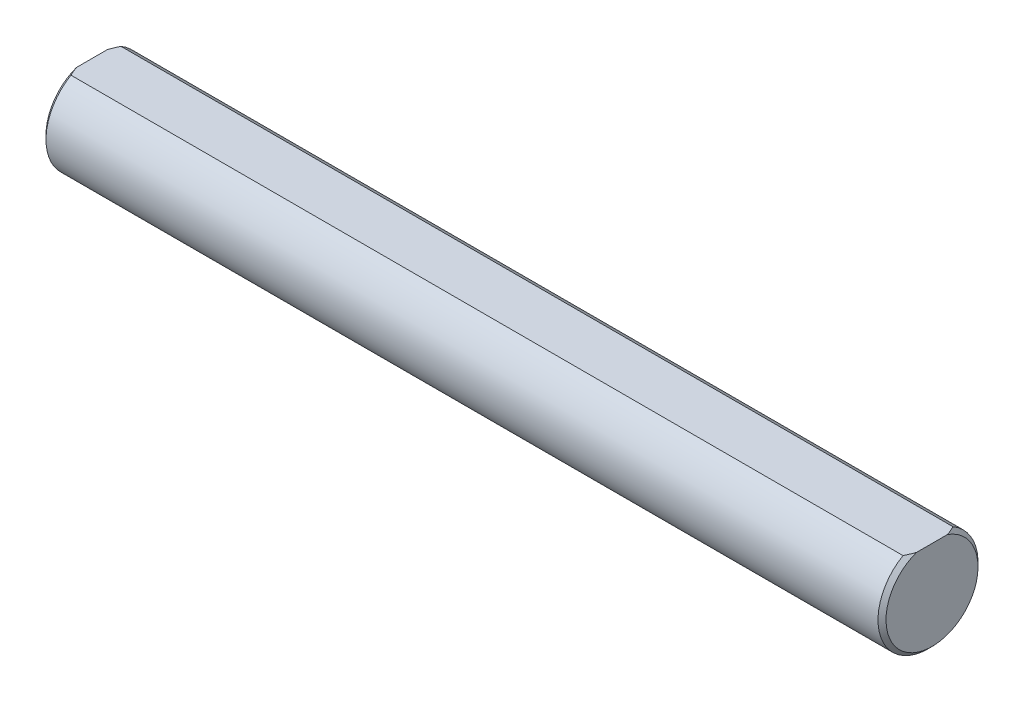
from build123d import *

# Parameters (mm, degrees)
SKETCH1_R           = 3.175
BOSS_EXTRUDE1_DEPTH = 53.34
CHAMFER1_SIZE       = 0.254
CUT_EXTRUDE2_DEPTH  = 54.528654476


with BuildPart() as part:
    # Sketch1 → Boss-Extrude1 (new body)
    with BuildSketch(Plane(origin=(0, 0, 0), x_dir=(0, 0, -1), z_dir=(1, 0, 0))):
        Circle(SKETCH1_R)
    extrude(amount=BOSS_EXTRUDE1_DEPTH)

    # Chamfer1
    chamfer1_edges = [part.edges().sort_by_distance(p)[0] for p in [
        (0, 0, 3.175),
        (53.34, 0, 3.175),
    ]]
    chamfer(chamfer1_edges, length=CHAMFER1_SIZE)

    # Sketch2 → Cut-Extrude2 (cut, through all)
    with BuildSketch(Plane(origin=(53.34, 0, 0), x_dir=(0, 0, -1), z_dir=(1, 0, 0))):
        with BuildLine():
            Line((-1.5875, 2.749630657), (1.5875, 2.749630657))
            ThreePointArc((1.5875, 2.749630657), (0, 3.175), (-1.5875, 2.749630657))
        make_face()
    extrude(amount=-CUT_EXTRUDE2_DEPTH, mode=Mode.SUBTRACT)


solid = part.part
